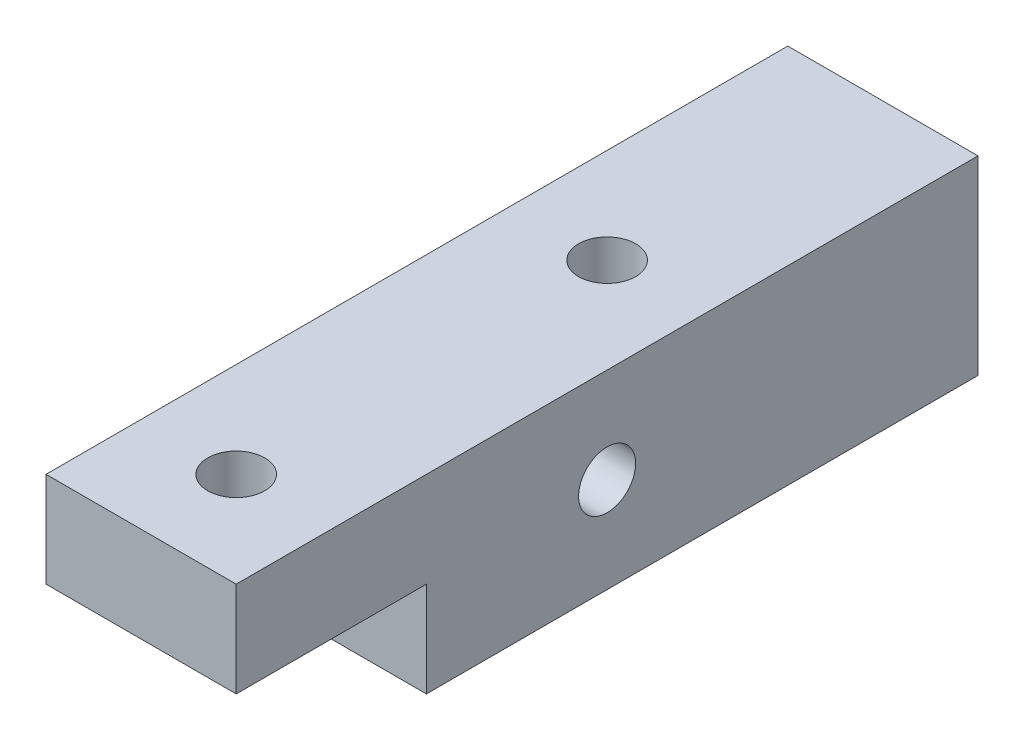
from build123d import *

# Parameters (mm, degrees)
ESQUISSE1_W             = 10
ESQUISSE1_H             = 10
BOSS_EXTRU_1_DEPTH      = 39
ESQUISSE2_W             = 10
ESQUISSE2_H             = 5
ENL_V_MAT_EXTRU_1_DEPTH = 10
ESQUISSE3_R             = 1.5
ENL_V_MAT_EXTRU_2_DEPTH = 10
ESQUISSE4_R             = 1.5
ENL_V_MAT_EXTRU_3_DEPTH = 42.484937025
ESQUISSE5_R             = 1.5
ENL_V_MAT_EXTRU_4_DEPTH = 42.484937025
ESQUISSE6_R             = 1.5
ENL_V_MAT_EXTRU_5_DEPTH = 42.484937025


with BuildPart() as part:
    # Esquisse1 → Boss.-Extru.1 (new body)
    with BuildSketch(Plane.XY):
        with Locations((5, 5)):
            Rectangle(ESQUISSE1_W, ESQUISSE1_H)
    extrude(amount=BOSS_EXTRU_1_DEPTH)

    # Esquisse2 → Enlèv. mat.-Extru.1 (cut)
    with BuildSketch(Plane.ZY):
        with Locations((34, 2.5)):
            Rectangle(ESQUISSE2_W, ESQUISSE2_H)
    extrude(amount=-ENL_V_MAT_EXTRU_1_DEPTH, mode=Mode.SUBTRACT)

    # Esquisse3 → Enlèv. mat.-Extru.2 (cut)
    with BuildSketch(Plane(origin=(0, 0, 0), x_dir=(-1, 0, 0), z_dir=(0, 0, -1))):
        with Locations((-5, 5)):
            Circle(ESQUISSE3_R)
    extrude(amount=-ENL_V_MAT_EXTRU_2_DEPTH, mode=Mode.SUBTRACT)

    # Esquisse4 → Enlèv. mat.-Extru.3 (cut, through all)
    with BuildSketch(Plane(origin=(0, 10, 0), x_dir=(1, 0, 0), z_dir=(0, 1, 0))):
        with Locations(Location((5, -34, 0), (0, 0, 270))):
            Circle(ESQUISSE4_R)
    extrude(amount=-ENL_V_MAT_EXTRU_3_DEPTH, mode=Mode.SUBTRACT)

    # Esquisse5 → Enlèv. mat.-Extru.4 (cut, through all)
    with BuildSketch(Plane.ZY):
        with Locations((19.5, 5)):
            Circle(ESQUISSE5_R)
    extrude(amount=-ENL_V_MAT_EXTRU_4_DEPTH, mode=Mode.SUBTRACT)

    # Esquisse6 → Enlèv. mat.-Extru.5 (cut, through all)
    with BuildSketch(Plane(origin=(0, 10, 0), x_dir=(1, 0, 0), z_dir=(0, 1, 0))):
        with Locations(Location((5, -14.5, 0), (0, 0, 270))):
            Circle(ESQUISSE6_R)
    extrude(amount=-ENL_V_MAT_EXTRU_5_DEPTH, mode=Mode.SUBTRACT)


solid = part.part
